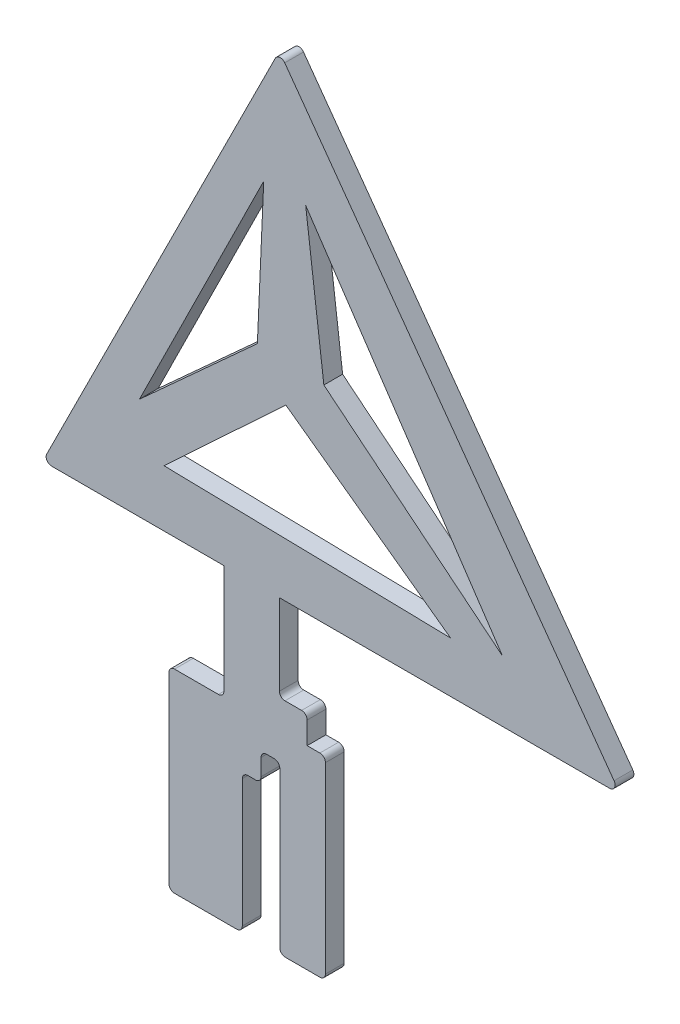
from build123d import *

# Parameters (mm, degrees)
BOSS_EXTRUDE2_DEPTH = 4.2926
BOSS_EXTRUDE3_DEPTH = 4.2926
SKETCH5_W           = 4.2926
SKETCH5_H           = 31.75
CUT_EXTRUDE2_DEPTH  = 4.2926
SKETCH6_W           = 4.2926
SKETCH6_H           = 38.1
CUT_EXTRUDE3_DEPTH  = 4.2926
SKETCH9_W           = 4.2926
SKETCH9_H           = 44.45
BOSS_EXTRUDE4_DEPTH = 6.35
SKETCH10_W          = 4.2926
SKETCH10_H          = 6.35
BOSS_EXTRUDE5_DEPTH = 6.35
SKETCH12_W          = 4.2926
SKETCH12_H          = 44.45
BOSS_EXTRUDE6_DEPTH = 8.382
FILLET4_R           = 1.27
CUT_EXTRUDE1_DEPTH  = 4.2926


with BuildPart() as part:
    # Sketch2 → Boss-Extrude2 (new body)
    with BuildSketch(Plane.XY):
        Polygon((-47.828182898, 48.384354874), (-6.35, 48.384354874), (-6.35, 22.225), (-10.541, 22.225), (-10.541, -22.225), (10.541, -22.225), (10.541, 22.225), (6.35, 22.225), (6.35, 48.384354874), (84.403334241, 48.384354874), (6.35, 156.723399657), align=None)
    extrude(amount=BOSS_EXTRUDE2_DEPTH)

    # Sketch2<3> → Boss-Extrude3 (add)
    with BuildSketch(Plane.XY):
        Polygon((-6.35, 101.6), (6.35, 101.6), (6.35, 156.723399657), (-47.828182898, 48.384354874), (-6.35, 48.384354874), align=None)
    extrude(amount=BOSS_EXTRUDE3_DEPTH)

    # Sketch5 → Cut-Extrude2 (cut)
    with BuildSketch(Plane(origin=(0, 0, 0), x_dir=(-1, 0, 0), z_dir=(0, 0, -1))):
        with Locations((0, -6.35)):
            Rectangle(SKETCH5_W, SKETCH5_H)
    extrude(amount=-CUT_EXTRUDE2_DEPTH, mode=Mode.SUBTRACT)

    # Sketch6 → Cut-Extrude3 (cut)
    with BuildSketch(Plane(origin=(0, 0, 0), x_dir=(-1, 0, 0), z_dir=(0, 0, -1))):
        with Locations((-4.2926, -3.175)):
            Rectangle(SKETCH6_W, SKETCH6_H)
    extrude(amount=-CUT_EXTRUDE3_DEPTH, mode=Mode.SUBTRACT)

    # Sketch9 → Boss-Extrude4 (add)
    with BuildSketch(Plane(origin=(10.541, 0, 0), x_dir=(0, 0, -1), z_dir=(1, 0, 0))):
        with Locations((-2.1463, 0)):
            Rectangle(SKETCH9_W, SKETCH9_H)
    extrude(amount=BOSS_EXTRUDE4_DEPTH)

    # Sketch10 → Boss-Extrude5 (add)
    with BuildSketch(Plane(origin=(6.35, 0, 0), x_dir=(0, 0, -1), z_dir=(1, 0, 0))):
        with Locations((-2.1463, 25.4)):
            Rectangle(SKETCH10_W, SKETCH10_H)
    extrude(amount=BOSS_EXTRUDE5_DEPTH)

    # Sketch12 → Boss-Extrude6 (add)
    with BuildSketch(Plane.ZY.offset(10.541)):
        with Locations((2.1463, 0)):
            Rectangle(SKETCH12_W, SKETCH12_H)
    extrude(amount=BOSS_EXTRUDE6_DEPTH)

    # Fillet4
    fillet4_edges = [part.edges().sort_by_distance(p)[0] for p in [
        (6.4389, 15.875, 2.1463),
        (2.1463, 15.875, 2.1463),
        (-2.1463, 9.525, 2.1463),
        (2.1463, 9.525, 2.1463),
        (-6.35, 22.225, 2.1463),
        (-2.1463, -22.225, 2.1463),
        (6.4389, -22.225, 2.1463),
        (16.891, -22.225, 2.1463),
        (16.891, 22.225, 2.1463),
        (6.35, 28.575, 2.1463),
        (12.7, 28.575, 2.1463),
        (-18.923, -22.225, 2.1463),
        (-18.923, 22.225, 2.1463),
        (6.35, 156.723399657, 2.1463),
        (-47.828182898, 48.384354874, 2.1463),
        (84.403334241, 48.384354874, 2.1463),
    ]]
    fillet(fillet4_edges, radius=FILLET4_R)

    # Sketch4 → Cut-Extrude1 (cut)
    with BuildSketch(Plane(origin=(0, 0, 0), x_dir=(-1, 0, 0), z_dir=(0, 0, -1))):
        Polygon((-2.761203873, 129.144568559), (-1.308492387, 96.220137091), (25.689356606, 71.698449698), align=None)
        Polygon((-12.368070704, 129.144568559), (-16.525699657, 95.623732399), (-57.420105949, 62.352675196), align=None)
        Polygon((-7.819762817, 87.308153563), (-45.531165478, 59.983677251), (20.045786345, 61.339421803), align=None)
    extrude(amount=-CUT_EXTRUDE1_DEPTH, mode=Mode.SUBTRACT)


solid = part.part
